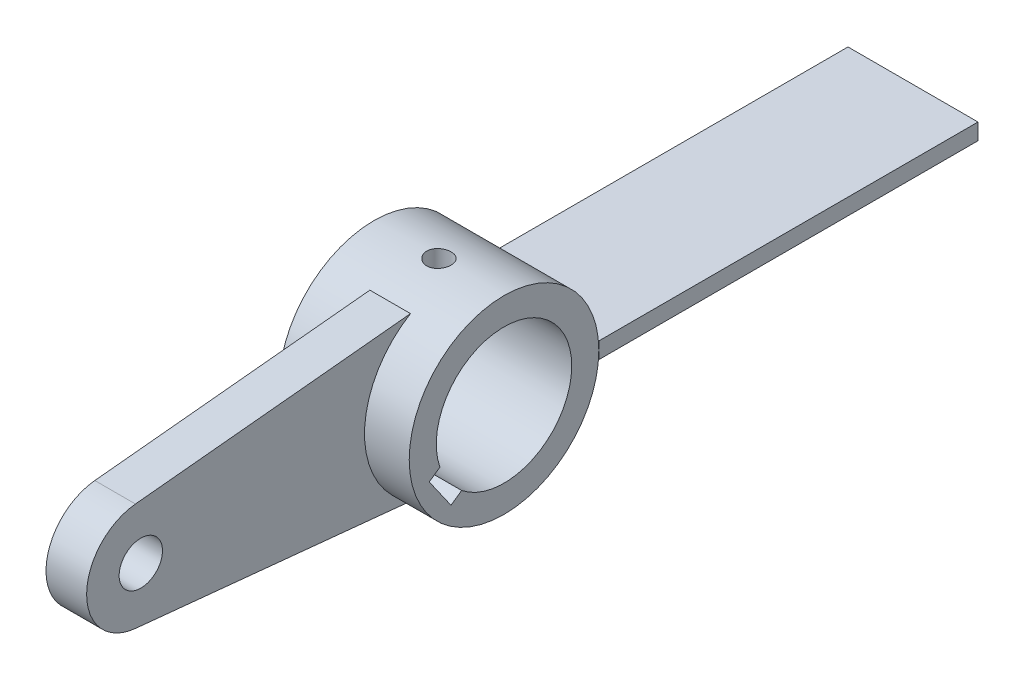
from build123d import *

# Parameters (mm, degrees)
SKETCH1_R           = 35
SKETCH1_R_2         = 25
BOSS_EXTRUDE1_DEPTH = 24
BOSS_EXTRUDE2_DEPTH = 7.5
SKETCH3_R           = 8
CUT_EXTRUDE1_DEPTH  = 15
CUT_EXTRUDE2_DEPTH  = 150.875815261
SKETCH6_R           = 4.5
CUT_EXTRUDE3_DEPTH  = 24
SKETCH7_W           = 48
SKETCH7_H           = 6
BOSS_EXTRUDE3_DEPTH = 140


with BuildPart() as part:
    # Sketch1 → Boss-Extrude1 (new, symmetric)
    with BuildSketch(Plane(origin=(0, 0, 0), x_dir=(0, 0, -1), z_dir=(1, 0, 0))):
        Circle(SKETCH1_R)
        Circle(SKETCH1_R_2, mode=Mode.SUBTRACT)
    extrude(amount=BOSS_EXTRUDE1_DEPTH, both=True)

    # Sketch2 → Boss-Extrude2 (add, symmetric)
    with BuildSketch(Plane(origin=(0, 0, 0), x_dir=(0, 0, -1), z_dir=(1, 0, 0))):
        with BuildLine():
            Line((-18.027756377, 30), (-119.579019246, 19.901846216))
            ThreePointArc((-119.579019246, 19.901846216), (-137.6, 0), (-119.579019246, -19.901846216))
            Line((-119.579019246, -19.901846216), (-18.027756377, -30))
            ThreePointArc((-18.027756377, -30), (-35, 0), (-18.027756377, 30))
        make_face()
    extrude(amount=BOSS_EXTRUDE2_DEPTH, both=True)

    # Sketch3 → Cut-Extrude1 (cut)
    with BuildSketch(Plane(origin=(7.5, 0, 0), x_dir=(0, 0, -1), z_dir=(1, 0, 0))):
        with Locations((-117.6, 0)):
            Circle(SKETCH3_R)
    extrude(amount=-CUT_EXTRUDE1_DEPTH, mode=Mode.SUBTRACT)

    # Sketch5 → Cut-Extrude2 (cut, through all)
    with BuildSketch(Plane(origin=(24, 0, 0), x_dir=(0, 0, -1), z_dir=(1, 0, 0))):
        Polygon((-2.570566425, 6.745492133), (-27.60661393, -10.784937057), (-19.576543821, -22.253065677), (5.459503684, -4.722636487), align=None)
    extrude(amount=-CUT_EXTRUDE2_DEPTH, mode=Mode.SUBTRACT)

    # Sketch6 → Cut-Extrude3 (cut)
    with BuildSketch(Plane(origin=(0, 35, -70), x_dir=(1, 0, 0), z_dir=(0, -1, 0))):
        with Locations(Location((0, 70, 0), (0, 0, 90))):
            Circle(SKETCH6_R)
    extrude(amount=CUT_EXTRUDE3_DEPTH, mode=Mode.SUBTRACT)


with BuildPart() as body_2:
    # Sketch7 → Boss-Extrude3 (new body)
    with BuildSketch(Plane.XY.offset(-35)):
        Rectangle(SKETCH7_W, SKETCH7_H)
    extrude(amount=-BOSS_EXTRUDE3_DEPTH)


solid = Compound([part.part, body_2.part])
